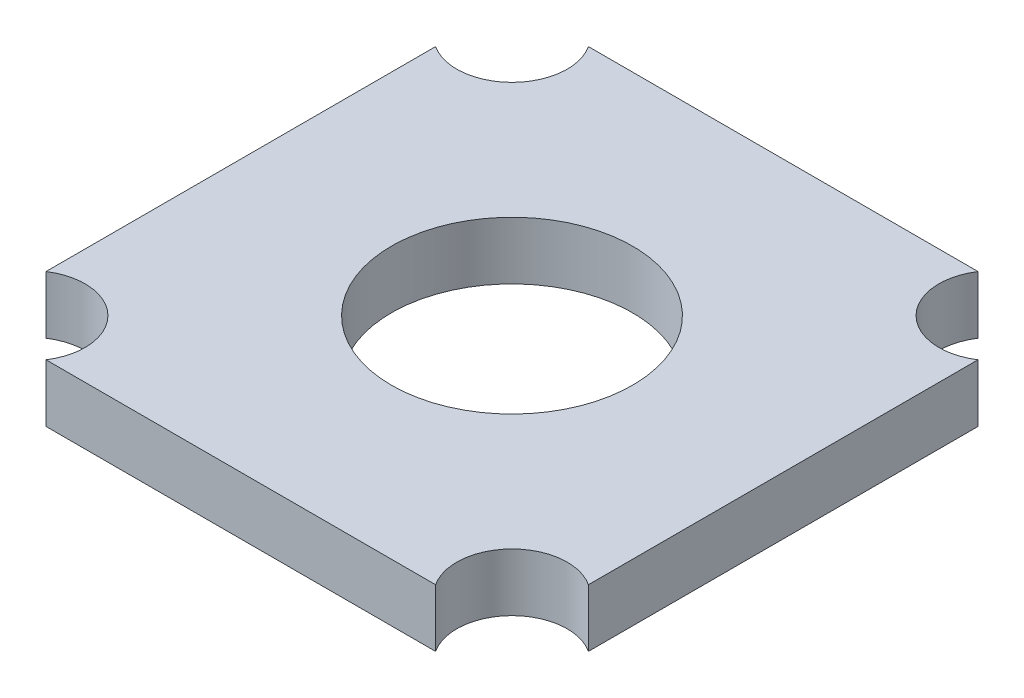
from build123d import *

# Parameters (mm, degrees)
SKETCH1_W           = 171.45
SKETCH1_H           = 171.45
BOSS_EXTRUDE1_DEPTH = 18.25625
SKETCH2_R           = 17.4625
CUT_EXTRUDE1_DEPTH  = 123.60033407
SKETCH5_R           = 38.1
CUT_EXTRUDE2_DEPTH  = 123.60033407


with BuildPart() as part:
    # Sketch1 → Boss-Extrude1 (new body)
    with BuildSketch(Plane(origin=(0, 0, 0), x_dir=(1, 0, 0), z_dir=(0, 1, 0))):
        Rectangle(SKETCH1_W, SKETCH1_H)
    extrude(amount=BOSS_EXTRUDE1_DEPTH)

    # Sketch2 → Cut-Extrude1 (cut, through all)
    with BuildSketch(Plane(origin=(0, 18.25625, 0), x_dir=(1, 0, 0), z_dir=(0, 1, 0))):
        with Locations((-76.2, 76.2)):
            Circle(SKETCH2_R)
        with Locations((76.2, 76.2)):
            Circle(SKETCH2_R)
        with Locations((76.2, -76.2)):
            Circle(SKETCH2_R)
        with Locations((-76.2, -76.2)):
            Circle(SKETCH2_R)
    extrude(amount=-CUT_EXTRUDE1_DEPTH, mode=Mode.SUBTRACT)

    # Sketch5 → Cut-Extrude2 (cut, through all)
    with BuildSketch(Plane(origin=(0, 18.25625, 0), x_dir=(1, 0, 0), z_dir=(0, 1, 0))):
        with Locations(Location((0, 0, 0), (0, 0, 270))):
            Circle(SKETCH5_R)
    extrude(amount=-CUT_EXTRUDE2_DEPTH, mode=Mode.SUBTRACT)


solid = part.part
